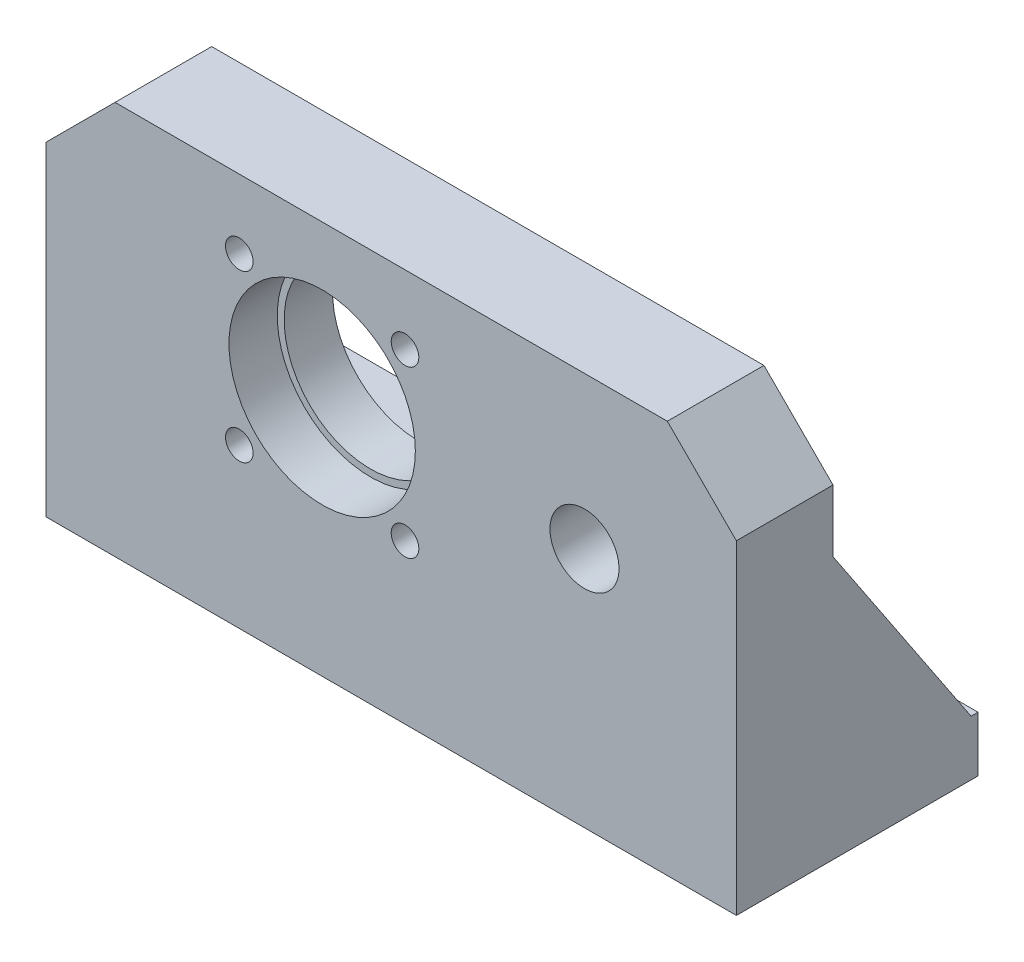
from build123d import *

# Parameters (mm, degrees)
SKETCH1_R                 = 13.5
BOSS_EXTRUDE1_DEPTH       = 14
BOSS_EXTRUDE2_START       = -7
SKETCH2_R                 = 13.5
SKETCH2_R_2               = 12.5
BOSS_EXTRUDE2_DEPTH       = 7
SKETCH16_W                = 100
SKETCH16_H                = 35
BOSS_EXTRUDE3_DEPTH       = 8
BOSS_EXTRUDE4_DEPTH       = 8
F_4_0MM_DOWEL_HOLE1_D     = 4
F_4_0MM_DOWEL_HOLE1_DEPTH = 10
F_4_0MM_DOWEL_HOLE1_TIP   = 1.201721238
SKETCH15_R                = 5
CUT_EXTRUDE1_DEPTH        = 78.781745931
CHAMFER1_SIZE             = 10


with BuildPart() as part:
    # Sketch1 → Boss-Extrude1 (new body)
    with BuildSketch(Plane.XY):
        Polygon((-40, -8), (-40, -35), (60, -35), (60, 3.080013472), (60, 22), (-40, 22), align=None)
        Circle(SKETCH1_R, mode=Mode.SUBTRACT)
    extrude(amount=BOSS_EXTRUDE1_DEPTH)

    # Sketch2 → Boss-Extrude2 (add)
    with BuildSketch(Plane.XY.offset(14).offset(BOSS_EXTRUDE2_START)):
        Circle(SKETCH2_R)
        Circle(SKETCH2_R_2, mode=Mode.SUBTRACT)
    extrude(amount=BOSS_EXTRUDE2_DEPTH)

    # Sketch16 → Boss-Extrude3 (add)
    with BuildSketch(Plane.XZ.offset(35)):
        with Locations((10, 17.5)):
            Rectangle(SKETCH16_W, SKETCH16_H)
    extrude(amount=-BOSS_EXTRUDE3_DEPTH)

    # Sketch17 → Boss-Extrude4 (add)
    with BuildSketch(Plane(origin=(60, 0, 0), x_dir=(0, 0, -1), z_dir=(1, 0, 0))):
        Polygon((-34, -27), (-14, 3), (-14, -27), align=None)
    boss_extrude4 = extrude(amount=-BOSS_EXTRUDE4_DEPTH)

    # Mirror1: Boss-Extrude4 across plane
    add(boss_extrude4.mirror(Plane(origin=(10, 0, 0), x_dir=(0, 0, 1), z_dir=(1, 0, 0))))

    # Ø4.0mm Dowel Hole1
    with Locations(Plane(origin=(0, 0, 0), x_dir=(-1, 0, 0), z_dir=(0, 0, -1))):
        with Locations((-12, 12), (12, 12), (12, -12), (-12, -12)):
            Hole(F_4_0MM_DOWEL_HOLE1_D / 2, depth=F_4_0MM_DOWEL_HOLE1_DEPTH)
            with Locations((0, 0, -(F_4_0MM_DOWEL_HOLE1_DEPTH + F_4_0MM_DOWEL_HOLE1_TIP / 2))):  # 118° drill point
                Cone(0, F_4_0MM_DOWEL_HOLE1_D / 2, F_4_0MM_DOWEL_HOLE1_TIP, mode=Mode.SUBTRACT)

    # Sketch15 → Cut-Extrude1 (cut, through all)
    with BuildSketch(Plane(origin=(0, 0, 0), x_dir=(-1, 0, 0), z_dir=(0, 0, -1))):
        with Locations((-38, 0)):
            Circle(SKETCH15_R)
    extrude(amount=-CUT_EXTRUDE1_DEPTH, mode=Mode.SUBTRACT)


with BuildPart() as body_2:
    # Mirror2: mirrored copy
    add(part.part.mirror(Plane.XY))

    # Chamfer1
    chamfer1_edges = [body_2.edges().sort_by_distance(p)[0] for p in [
        (-40, 22, -7),
        (60, 22, -7),
    ]]
    chamfer(chamfer1_edges, length=CHAMFER1_SIZE)


solid = body_2.part
